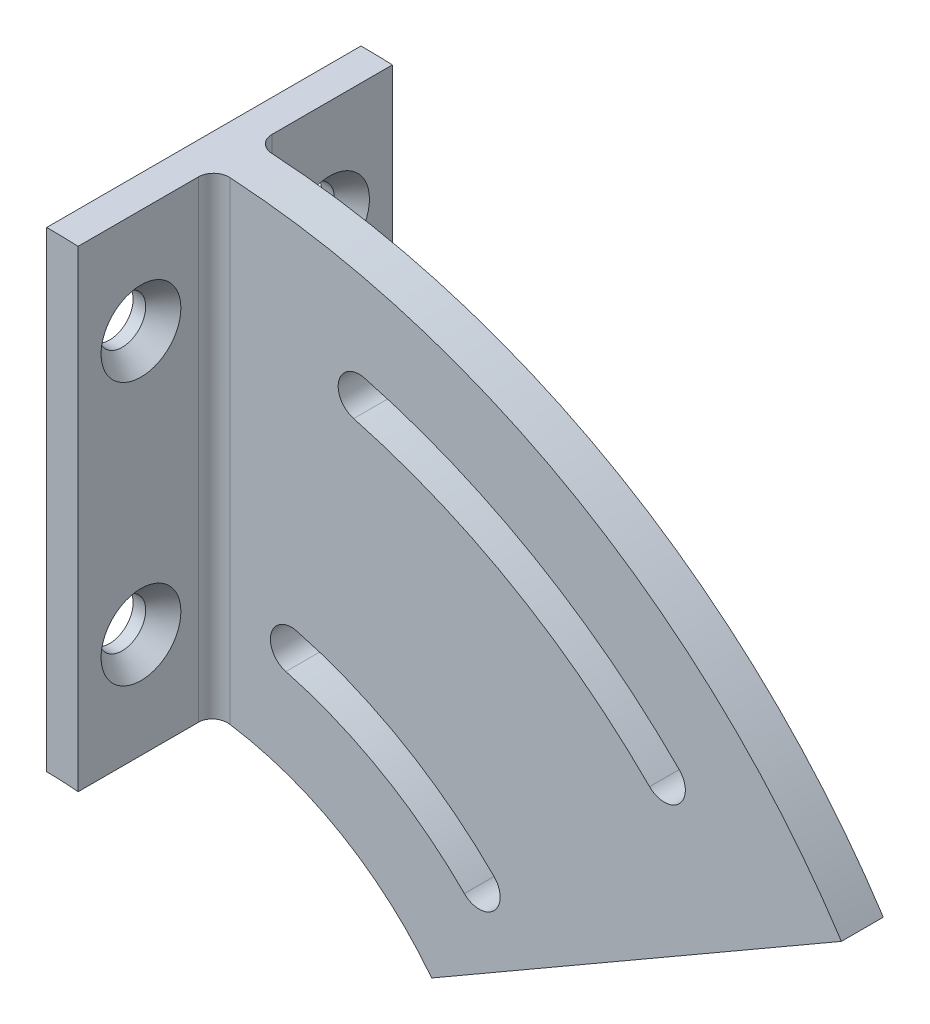
from build123d import *

# Parameters (mm, degrees)
BOSS_EXTRUDE1_DEPTH                               = 2
BOSS_EXTRUDE2_DEPTH                               = 15
CSK_FOR_8_FLAT_HEAD_SOCKET_CAP_SCREW1_D           = 4.4958
CSK_FOR_8_FLAT_HEAD_SOCKET_CAP_SCREW1_DEPTH       = 15
CSK_FOR_8_FLAT_HEAD_SOCKET_CAP_SCREW1_CSINK_D     = 7.62
CSK_FOR_8_FLAT_HEAD_SOCKET_CAP_SCREW1_CSINK_ANGLE = 82
CSK_FOR_8_FLAT_HEAD_SOCKET_CAP_SCREW1_TIP         = 0.7087601475210669
FILLET1_R                                         = 1.5


with BuildPart() as part:
    # Sketch1 → Boss-Extrude1 (new, symmetric)
    with BuildSketch(Plane.XY):
        with BuildLine():
            ThreePointArc((3.0000000000000036, 29.84962311319859), (14.561896892531825, 26.228823055777227), (23.748786379167363, 18.330170362456368))
            Line((23.748786379167367, 18.33017036245637), (62.85946345754006, 40.910730301843614))
            ThreePointArc((62.859463457540045, 40.910730301843614), (37.065679841305055, 65.20073142152523), (2.9999999999999964, 74.93997598078077))
            Line((2.999999999999999, 74.93997598078074), (3, 29.849623113198593))
        make_face()
        with BuildLine():
            ThreePointArc((10.870399894306182, 40.568884704140785), (21.000000000000167, 36.373066958946325), (29.698484809835048, 29.698484809834948))
            ThreePointArc((29.698484809835044, 29.698484809834945), (29.69848480983504, 26.870057685088753), (26.87005768508885, 26.870057685088756))
            ThreePointArc((26.870057685088845, 26.87005768508876), (19.000000000000156, 32.90896534380858), (9.835123713896072, 36.70518139898452))
            ThreePointArc((9.835123713896072, 36.70518139898452), (8.420910151522994, 39.15467114176771), (10.870399894306184, 40.568884704140785))
        make_face(mode=Mode.SUBTRACT)
        with BuildLine():
            ThreePointArc((17.340876021869384, 64.71703036136746), (33.500000000000284, 58.023702053557244), (47.37615433949878, 47.37615433949861))
            ThreePointArc((47.37615433949877, 47.3761543394986), (47.376154339498754, 44.547727214752406), (44.54772721475256, 44.54772721475241))
            ThreePointArc((44.54772721475258, 44.54772721475243), (31.50000000000025, 54.55960043841949), (16.30559984145927, 60.85332705621119))
            ThreePointArc((16.30559984145927, 60.85332705621118), (14.891386279086177, 63.302816798994385), (17.340876021869388, 64.71703036136746))
        make_face(mode=Mode.SUBTRACT)
    extrude(amount=BOSS_EXTRUDE1_DEPTH, both=True)

    # Sketch1<3> → Boss-Extrude2 (add, symmetric)
    with BuildSketch(Plane.XY):
        with BuildLine():
            ThreePointArc((1.78e-15, 30), (1.501883251794565, 29.962382193309978), (3.0000000000000036, 29.84962311319859))
            Line((3, 29.849623113198593), (2.999999999999999, 74.93997598078074))
            ThreePointArc((2.9999999999999964, 74.93997598078077), (1.5003002101982155, 74.98499249369355), (-1.066e-14, 75))
            Line((0, 75), (0, 30))
        make_face()
    extrude(amount=BOSS_EXTRUDE2_DEPTH, both=True)

    # CSK for #8 Flat Head Socket Cap Screw1
    with Locations(Plane(origin=(3.0000000000000004, 6e-17, 0), x_dir=(0, 0, -1), z_dir=(1, 2e-17, 0))):
        with Locations((-9, 64.939975981), (9, 64.939975981), (9, 39.849623113), (-9, 39.849623113)):
            CounterSinkHole(CSK_FOR_8_FLAT_HEAD_SOCKET_CAP_SCREW1_D / 2, CSK_FOR_8_FLAT_HEAD_SOCKET_CAP_SCREW1_CSINK_D / 2, depth=CSK_FOR_8_FLAT_HEAD_SOCKET_CAP_SCREW1_DEPTH, counter_sink_angle=CSK_FOR_8_FLAT_HEAD_SOCKET_CAP_SCREW1_CSINK_ANGLE)
            with Locations((0, 0, -(CSK_FOR_8_FLAT_HEAD_SOCKET_CAP_SCREW1_DEPTH + CSK_FOR_8_FLAT_HEAD_SOCKET_CAP_SCREW1_TIP / 2))):  # 145° drill point
                Cone(0, CSK_FOR_8_FLAT_HEAD_SOCKET_CAP_SCREW1_D / 2, CSK_FOR_8_FLAT_HEAD_SOCKET_CAP_SCREW1_TIP, mode=Mode.SUBTRACT)

    # Fillet1
    fillet1_edges = [part.edges().sort_by_distance(p)[0] for p in [
        (2.9999999999999996, 52.39479954698967, 2),
        (2.9999999999999996, 52.39479954698967, -2),
    ]]
    fillet(fillet1_edges, radius=FILLET1_R)


solid = part.part
